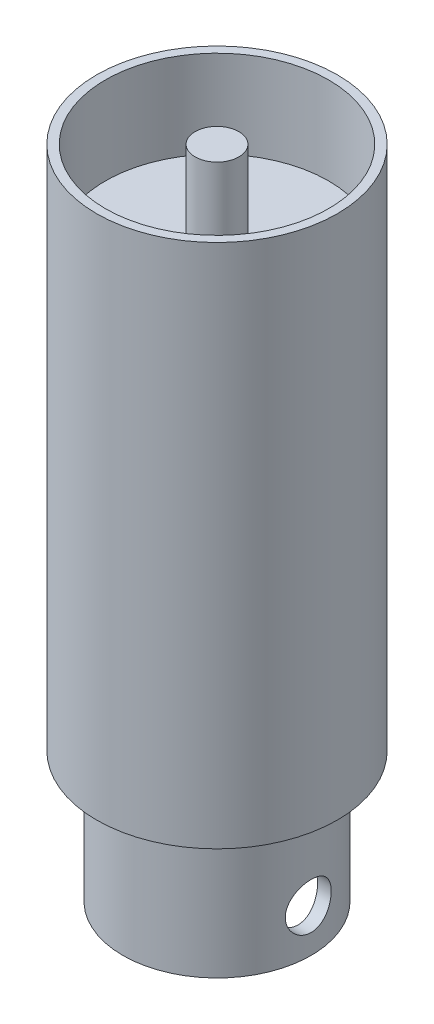
from build123d import *

# Parameters (mm, degrees)
SKETCH1_R                       = 13.75
BOSS_EXTRUDE1_DEPTH             = 60
SKETCH5_R                       = 10.75
BOSS_EXTRUDE2_DEPTH             = 14.9
CUT_EXTRUDE1_START              = -20
CUT_EXTRUDE1_DEPTH              = 20
CUT_EXTRUDE2_DEPTH              = 64.072379058
CUT_EXTRUDE2_DEPTH_BACK         = 64.072379058
SKETCH7_R                       = 2.625
BOSS_EXTRUDE3_REACH             = 65.072
SKETCH8_R                       = 2.625
BOSS_EXTRUDE3_DIRECTION_2_REACH = 65.072
SKETCH9_R                       = 12.75
SKETCH9_R_2                     = 2.5
CUT_EXTRUDE3_DEPTH              = 10


with BuildPart() as part:
    # Sketch1 → Boss-Extrude1 (new body)
    with BuildSketch(Plane(origin=(0, 0, 0), x_dir=(1, 0, 0), z_dir=(0, 1, 0))):
        Circle(SKETCH1_R)
    extrude(amount=BOSS_EXTRUDE1_DEPTH)

    # Sketch5 → Boss-Extrude2 (add)
    with BuildSketch(Plane.XZ):
        Circle(SKETCH5_R)
        with BuildLine():
            ThreePointArc((-0.75, -9.219544457), (-9.25, 0), (-0.75, 9.219544457))
            Line((-0.75, 9.219544457), (-0.75, -9.219544457))
        make_face(mode=Mode.SUBTRACT)
        with BuildLine():
            Line((0.75, -9.219544457), (0.75, 9.219544457))
            ThreePointArc((0.75, 9.219544457), (9.25, 0), (0.75, -9.219544457))
        make_face(mode=Mode.SUBTRACT)
    extrude(amount=BOSS_EXTRUDE2_DEPTH)

    # Sketch6 → Cut-Extrude1 (cut)
    with BuildSketch(Plane.XZ.offset(CUT_EXTRUDE1_START)):
        with BuildLine():
            Line((-0.75, -9.219544457), (-0.75, 9.219544457))
            ThreePointArc((-0.75, 9.219544457), (-9.25, 0), (-0.75, -9.219544457))
        make_face()
        with BuildLine():
            ThreePointArc((0.75, -9.219544457), (9.25, 0), (0.75, 9.219544457))
            Line((0.75, 9.219544457), (0.75, -9.219544457))
        make_face()
    extrude(amount=CUT_EXTRUDE1_DEPTH, mode=Mode.SUBTRACT)

    # Sketch7 → Cut-Extrude2 (cut, two sides: drawn at the far end of the back side and taken through both)
    with BuildSketch(Plane(origin=(0, 0, 0), x_dir=(0, 0, -1), z_dir=(1, 0, 0)).offset(-CUT_EXTRUDE2_DEPTH_BACK)):
        with Locations((0, -10)):
            Circle(SKETCH7_R)
    extrude(amount=CUT_EXTRUDE2_DEPTH + CUT_EXTRUDE2_DEPTH_BACK, mode=Mode.SUBTRACT)

    # Boss-Extrude3: up to this face of the body (flat: up to its plane)
    boss_extrude3_end = Plane(part.part.faces().sort_by_distance((0.75, 2.986865704, 0))[0])
    # Sketch8 → Boss-Extrude3 (add, up to the picked face)
    with BuildSketch(Plane(origin=(0, 0, 0), x_dir=(0, 0, -1), z_dir=(1, 0, 0)), mode=Mode.PRIVATE) as boss_extrude3_sk1:
        with Locations((0, -10)):
            Circle(SKETCH8_R)
    boss_extrude3_tool1 = split(extrude(boss_extrude3_sk1.sketch, amount=BOSS_EXTRUDE3_REACH, mode=Mode.PRIVATE), bisect_by=boss_extrude3_end, keep=Keep.BOTH, mode=Mode.PRIVATE)
    add(boss_extrude3_tool1.solids().sort_by(Axis((0, -10, 0), (1, 0, 0)))[0])

    # Boss-Extrude3 direction 2: up to this face of the body (flat: up to its plane)
    boss_extrude3_direction_2_end = Plane(part.part.faces().sort_by_distance((-0.75, 2.986865704, 0))[0])
    # Sketch8 → Boss-Extrude3 direction 2 (add, up to the picked face)
    with BuildSketch(Plane(origin=(0, 0, 0), x_dir=(0, 0, -1), z_dir=(1, 0, 0)), mode=Mode.PRIVATE) as boss_extrude3_direction_2_sk1:
        with Locations((0, -10)):
            Circle(SKETCH8_R)
    boss_extrude3_direction_2_tool1 = split(extrude(boss_extrude3_direction_2_sk1.sketch, amount=-BOSS_EXTRUDE3_DIRECTION_2_REACH, mode=Mode.PRIVATE), bisect_by=boss_extrude3_direction_2_end, keep=Keep.BOTH, mode=Mode.PRIVATE)
    add(boss_extrude3_direction_2_tool1.solids().sort_by(Axis((0, -10, 0), (-1, 0, 0)))[0])

    # Sketch9 → Cut-Extrude3 (cut)
    with BuildSketch(Plane(origin=(0, 60, 0), x_dir=(1, 0, 0), z_dir=(0, 1, 0))):
        Circle(SKETCH9_R)
        Circle(SKETCH9_R_2, mode=Mode.SUBTRACT)
    extrude(amount=-CUT_EXTRUDE3_DEPTH, mode=Mode.SUBTRACT)


solid = part.part
